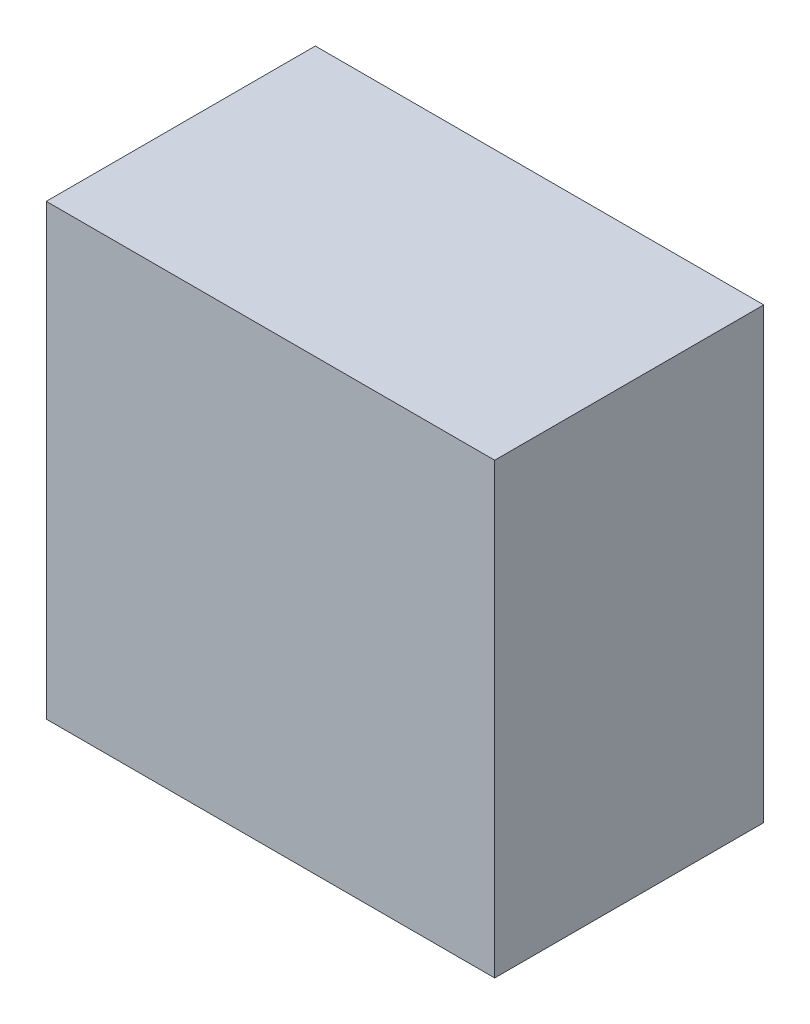
from build123d import *

# Parameters (mm, degrees)
SKETCH1_W           = 150
SKETCH1_H           = 150
BOSS_EXTRUDE1_DEPTH = 90


with BuildPart() as part:
    # Sketch1 → Boss-Extrude1 (new body)
    with BuildSketch(Plane.XY):
        Rectangle(SKETCH1_W, SKETCH1_H)
    extrude(amount=BOSS_EXTRUDE1_DEPTH)


solid = part.part
